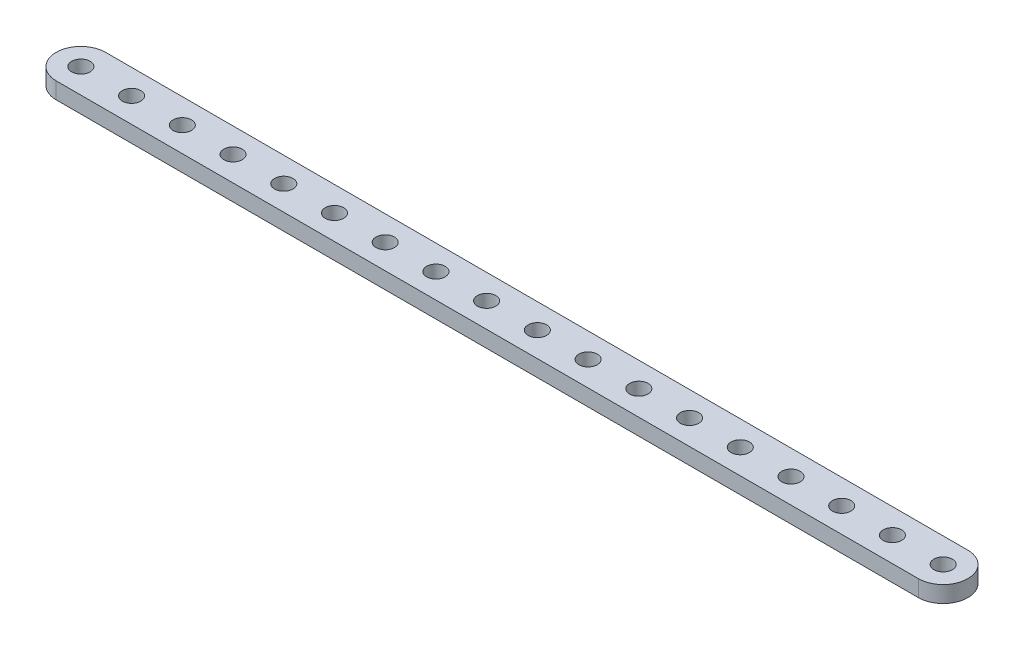
from build123d import *

# Parameters (mm, degrees)
SKETCH1_R               = 1.778
BOSS_EXTRUDE1_DEPTH     = 6.35
CUT_EXTRUDE1_DEPTH      = 103.859220114
CUT_EXTRUDE1_DEPTH_BACK = 103.859220114
SKETCH3_W               = 243.845776737
SKETCH3_H               = 94.534413445
CUT_EXTRUDE2_DEPTH      = 3.175


with BuildPart() as part:
    # Sketch1 → Boss-Extrude1 (new body)
    with BuildSketch(Plane(origin=(0, 6.35, 0), x_dir=(1, 0, 0), z_dir=(0, 1, 0))):
        with BuildLine():
            Line((97.79, 4.7625), (-97.79, 4.7625))
            ThreePointArc((-97.79, 4.7625), (-102.5525, 0), (-97.79, -4.7625))
            Line((-97.79, -4.7625), (97.79, -4.7625))
            ThreePointArc((97.79, -4.7625), (102.5525, 0), (97.79, 4.7625))
        make_face()
        with Locations(Location((97.79, 0, 0), (0, 0, 90))):
            Circle(SKETCH1_R, mode=Mode.SUBTRACT)
        with Locations(Location((88.011, 0, 0), (0, 0, 90))):
            Circle(SKETCH1_R, mode=Mode.SUBTRACT)
        with Locations(Location((78.232, 0, 0), (0, 0, 90))):
            Circle(SKETCH1_R, mode=Mode.SUBTRACT)
        with Locations(Location((68.453, 0, 0), (0, 0, 90))):
            Circle(SKETCH1_R, mode=Mode.SUBTRACT)
        with Locations(Location((58.674, 0, 0), (0, 0, 90))):
            Circle(SKETCH1_R, mode=Mode.SUBTRACT)
        with Locations(Location((48.895, 0, 0), (0, 0, 90))):
            Circle(SKETCH1_R, mode=Mode.SUBTRACT)
        with Locations(Location((39.116, 0, 0), (0, 0, 90))):
            Circle(SKETCH1_R, mode=Mode.SUBTRACT)
        with Locations(Location((29.337, 0, 0), (0, 0, 90))):
            Circle(SKETCH1_R, mode=Mode.SUBTRACT)
        with Locations(Location((19.558, 0, 0), (0, 0, 90))):
            Circle(SKETCH1_R, mode=Mode.SUBTRACT)
        with Locations(Location((9.779, 0, 0), (0, 0, 90))):
            Circle(SKETCH1_R, mode=Mode.SUBTRACT)
        with Locations(Location((0, 0, 0), (0, 0, 90))):
            Circle(SKETCH1_R, mode=Mode.SUBTRACT)
        with Locations(Location((-9.779, 0, 0), (0, 0, 90))):
            Circle(SKETCH1_R, mode=Mode.SUBTRACT)
        with Locations(Location((-19.558, 0, 0), (0, 0, 90))):
            Circle(SKETCH1_R, mode=Mode.SUBTRACT)
        with Locations(Location((-29.337, 0, 0), (0, 0, 90))):
            Circle(SKETCH1_R, mode=Mode.SUBTRACT)
        with Locations(Location((-39.116, 0, 0), (0, 0, 90))):
            Circle(SKETCH1_R, mode=Mode.SUBTRACT)
        with Locations(Location((-48.895, 0, 0), (0, 0, 90))):
            Circle(SKETCH1_R, mode=Mode.SUBTRACT)
        with Locations(Location((-58.674, 0, 0), (0, 0, 90))):
            Circle(SKETCH1_R, mode=Mode.SUBTRACT)
        with Locations(Location((-68.453, 0, 0), (0, 0, 90))):
            Circle(SKETCH1_R, mode=Mode.SUBTRACT)
        with Locations(Location((-78.232, 0, 0), (0, 0, 90))):
            Circle(SKETCH1_R, mode=Mode.SUBTRACT)
        with Locations(Location((-88.011, 0, 0), (0, 0, 90))):
            Circle(SKETCH1_R, mode=Mode.SUBTRACT)
        with Locations(Location((-97.79, 0, 0), (0, 0, 90))):
            Circle(SKETCH1_R, mode=Mode.SUBTRACT)
    extrude(amount=-BOSS_EXTRUDE1_DEPTH)

    # Sketch2 → Cut-Extrude1 (cut, two sides: drawn at the far end of the back side and taken through both)
    with BuildSketch(Plane(origin=(0, 6.35, 0), x_dir=(1, 0, 0), z_dir=(0, 1, 0)).offset(-CUT_EXTRUDE1_DEPTH_BACK)):
        with BuildLine():
            Line((-68.453, -4.7625), (-109.387336875, -4.7625))
            Line((-109.387336875, -4.7625), (-109.387336875, 4.7625))
            Line((-109.387336875, 4.7625), (-68.453, 4.7625))
            ThreePointArc((-68.453, 4.7625), (-73.2155, 0), (-68.453, -4.7625))
        make_face()
    extrude(amount=CUT_EXTRUDE1_DEPTH + CUT_EXTRUDE1_DEPTH_BACK, mode=Mode.SUBTRACT)

    # Sketch3 → Cut-Extrude2 (cut)
    with BuildSketch(Plane(origin=(0, 6.35, 0), x_dir=(1, 0, 0), z_dir=(0, 1, 0))):
        with Locations((-6.250363069, -2.208747977)):
            Rectangle(SKETCH3_W, SKETCH3_H)
    extrude(amount=-CUT_EXTRUDE2_DEPTH, mode=Mode.SUBTRACT)


solid = part.part
